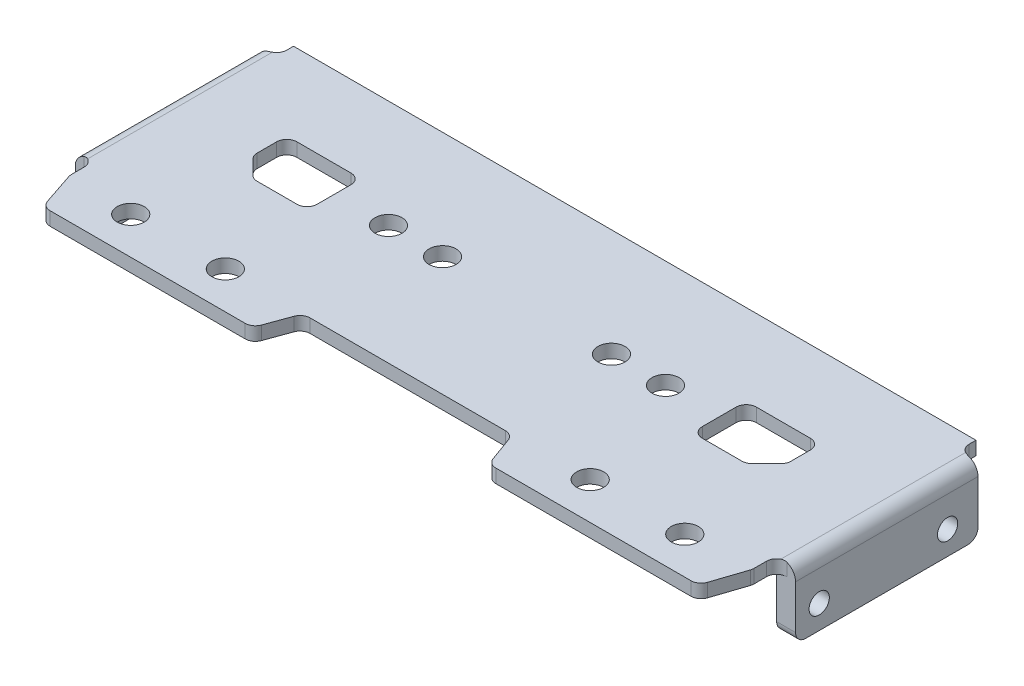
from build123d import *

# Parameters (mm, degrees)
SKETCH1_R           = 2
BOSS_EXTRUDE1_DEPTH = 2
SKETCH2_W           = 2.8
SKETCH2_H           = 27
BOSS_EXTRUDE2_DEPTH = 10
SKETCH3_R           = 1.5
CUT_EXTRUDE1_DEPTH  = 114.824325613
FILLET1_R           = 1.5
FILLET2_R           = 2


with BuildPart() as part:
    # Sketch1 → Boss-Extrude1 (new body)
    with BuildSketch(Plane(origin=(0, 0, 0), x_dir=(1, 0, 0), z_dir=(0, 1, 0))):
        Polygon((0, 6), (2, 0), (33, 0), (35, 5.5), (66, 5.5), (68, 0), (99, 0), (101, 6), (101, 39.094975397), (0, 39.094975397), align=None)
        with Locations(Location((9.5, 5.5, 0), (0, 0, 270))):
            Circle(SKETCH1_R, mode=Mode.SUBTRACT)
        with Locations(Location((23.5, 5.5, 0), (0, 0, 270))):
            Circle(SKETCH1_R, mode=Mode.SUBTRACT)
        with Locations(Location((77.5, 5.5, 0), (0, 0, 90))):
            Circle(SKETCH1_R, mode=Mode.SUBTRACT)
        with Locations(Location((91.5, 5.5, 0), (0, 0, 90))):
            Circle(SKETCH1_R, mode=Mode.SUBTRACT)
        with Locations(Location((30, 23.149785568, 0), (0, 0, 270))):
            Circle(SKETCH1_R, mode=Mode.SUBTRACT)
        with Locations(Location((38, 23.149785568, 0), (0, 0, 270))):
            Circle(SKETCH1_R, mode=Mode.SUBTRACT)
        with Locations(Location((63, 23.149785568, 0), (0, 0, 90))):
            Circle(SKETCH1_R, mode=Mode.SUBTRACT)
        with Locations(Location((71, 23.149785568, 0), (0, 0, 90))):
            Circle(SKETCH1_R, mode=Mode.SUBTRACT)
        Polygon((11, 22.094975397), (14, 19.094975397), (22, 19.094975397), (22, 27.094975397), (11, 27.094975397), align=None, mode=Mode.SUBTRACT)
        Polygon((90, 27.094975397), (90, 22.094975397), (87, 19.094975397), (79, 19.094975397), (79, 27.094975397), align=None, mode=Mode.SUBTRACT)
    extrude(amount=BOSS_EXTRUDE1_DEPTH)

    # Sketch2 → Boss-Extrude2 (add)
    with BuildSketch(Plane(origin=(0, 2, 0), x_dir=(1, 0, 0), z_dir=(0, 1, 0))):
        with Locations((-1.4, 23.094975397)):
            Rectangle(SKETCH2_W, SKETCH2_H)
        with Locations((102.4, 23.094975397)):
            Rectangle(SKETCH2_W, SKETCH2_H)
    extrude(amount=-BOSS_EXTRUDE2_DEPTH)

    # Sketch3 → Cut-Extrude1 (cut, through all)
    with BuildSketch(Plane(origin=(103.8, 0, 0), x_dir=(0, 0, -1), z_dir=(1, 0, 0))):
        with Locations((13.094975397, -4.5)):
            Circle(SKETCH3_R)
        with Locations((32.094975397, -4.5)):
            Circle(SKETCH3_R)
    extrude(amount=-CUT_EXTRUDE1_DEPTH, mode=Mode.SUBTRACT)

    # Fillet1
    fillet1_edges = [part.edges().sort_by_distance(p)[0] for p in [
        (-1.4, -8, -9.594975397),
        (-1.4, -8, -36.594975397),
        (0, 1, -9.594975397),
        (0, 1, -6),
        (2, 1, 0),
        (0, 1, -36.594975397),
        (102.4, -8, -36.594975397),
        (101, 1, -36.594975397),
        (102.4, -8, -9.594975397),
        (101, 1, -9.594975397),
        (101, 1, -6),
        (99, 1, 0),
        (66, 1, -5.5),
        (68, 1, 0),
        (90, 1, -27.094975397),
        (79, 1, -27.094975397),
        (90, 1, -22.094975397),
        (87, 1, -19.094975397),
        (79, 1, -19.094975397),
        (35, 1, -5.5),
        (33, 1, 0),
        (11, 1, -27.094975397),
        (11, 1, -22.094975397),
        (14, 1, -19.094975397),
        (22, 1, -19.094975397),
        (22, 1, -27.094975397),
    ]]
    fillet(fillet1_edges, radius=FILLET1_R)

    # Fillet2
    fillet2_edges = [part.edges().sort_by_distance(p)[0] for p in [
        (-2.8, 2, -23.094975397),
        (103.8, 2, -23.094975397),
    ]]
    fillet(fillet2_edges, radius=FILLET2_R)


solid = part.part
